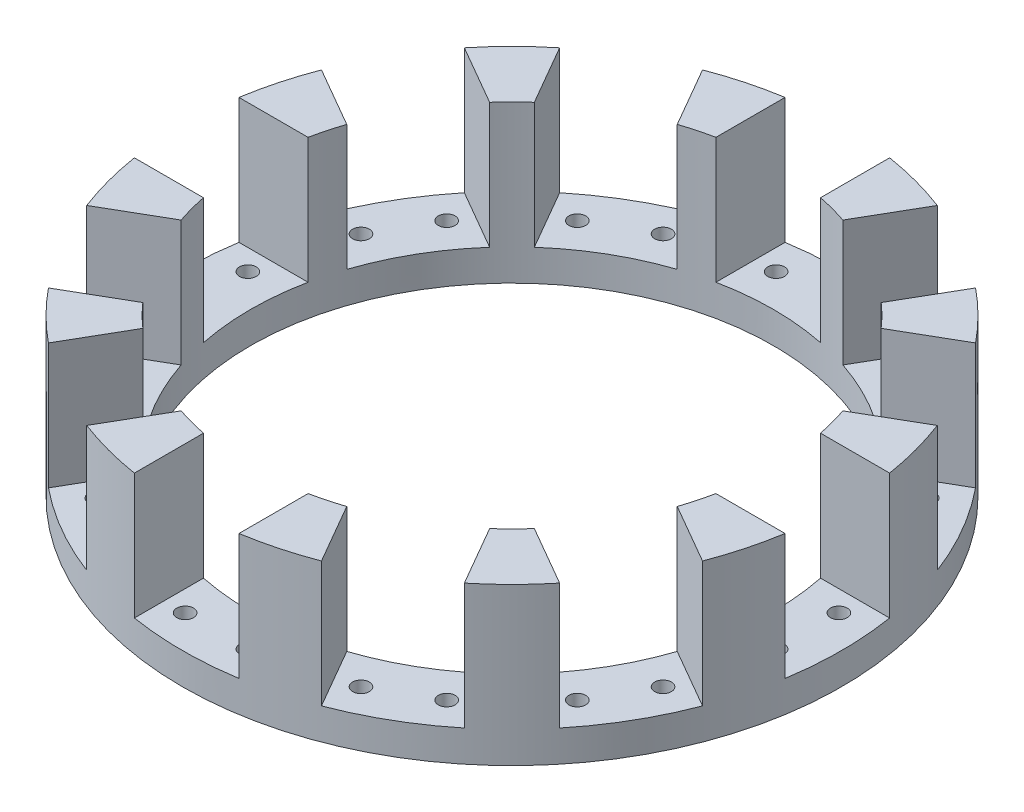
from build123d import *

# Parameters (mm, degrees)
SKETCH1_R           = 157.5
SKETCH1_R_2         = 125
BOSS_EXTRUDE1_DEPTH = 37.5
SKETCH2_W           = 50
SKETCH2_H           = 60
CUT_EXTRUDE1_DEPTH  = 226.873305196
CIRPATTERN1_COUNT   = 12
SKETCH3_R           = 4
CUT_EXTRUDE2_DEPTH  = 236.02659424
CIRPATTERN2_COUNT   = 12


with BuildPart() as part:
    # Sketch1 → Boss-Extrude1 (new, symmetric)
    with BuildSketch(Plane(origin=(0, 0, 0), x_dir=(1, 0, 0), z_dir=(0, 1, 0))):
        with Locations(Location((0, 0, 0), (0, 0, 270))):
            Circle(SKETCH1_R)
        with Locations(Location((0, 0, 0), (0, 0, 270))):
            Circle(SKETCH1_R_2, mode=Mode.SUBTRACT)
    extrude(amount=BOSS_EXTRUDE1_DEPTH, both=True)

    # Sketch2 → Cut-Extrude1 (cut, symmetric)
    with BuildSketch(Plane.XY):
        with Locations((0, 7.5)):
            Rectangle(SKETCH2_W, SKETCH2_H)
    cut_extrude1 = extrude(amount=CUT_EXTRUDE1_DEPTH, both=True, mode=Mode.SUBTRACT)

    # CirPattern1: Cut-Extrude1 ×12 about axis
    cirpattern1_axis = Axis((0, 0, 0), (0, 1, 0))
    for i in range(1, CIRPATTERN1_COUNT):
        add(cut_extrude1.rotate(cirpattern1_axis, i * 360 / CIRPATTERN1_COUNT), mode=Mode.SUBTRACT)

    # Sketch3 → Cut-Extrude2 (cut, through all)
    with BuildSketch(Plane.XZ.offset(37.5)):
        with Locations(Location((-15, 141.25, 0), (0, 0, 270))):
            Circle(SKETCH3_R)
        with Locations(Location((15, 141.25, 0), (0, 0, 270))):
            Circle(SKETCH3_R)
    cut_extrude2 = extrude(amount=-CUT_EXTRUDE2_DEPTH, mode=Mode.SUBTRACT)

    # CirPattern2: Cut-Extrude2 ×12 about axis
    cirpattern2_axis = Axis((0, 0, 0), (0, 1, 0))
    for i in range(1, CIRPATTERN2_COUNT):
        add(cut_extrude2.rotate(cirpattern2_axis, i * 360 / CIRPATTERN2_COUNT), mode=Mode.SUBTRACT)


solid = part.part
